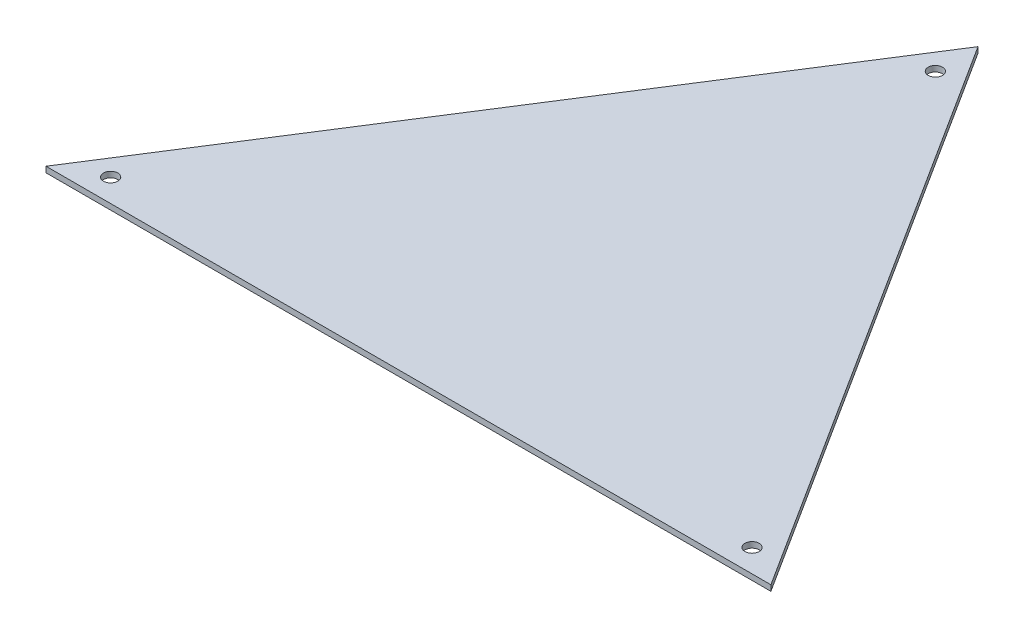
from build123d import *

# Parameters (mm, degrees)
SKETCH1_R           = 3.96875
BOSS_EXTRUDE1_DEPTH = 1.5875


with BuildPart() as part:
    # Sketch1 → Boss-Extrude1 (new, symmetric)
    with BuildSketch(Plane(origin=(0, 0, 0), x_dir=(1, 0, 0), z_dir=(0, 1, 0))):
        Polygon((0, 303.055391585), (-200.93524919, -12.7), (200.93524919, -12.7), align=None)
        with Locations(Location((-177.8, 0, 0), (0, 0, 270))):
            Circle(SKETCH1_R, mode=Mode.SUBTRACT)
        with Locations(Location((0, 279.4, 0), (0, 0, 270))):
            Circle(SKETCH1_R, mode=Mode.SUBTRACT)
        with Locations(Location((177.8, 0, 0), (0, 0, 270))):
            Circle(SKETCH1_R, mode=Mode.SUBTRACT)
    extrude(amount=BOSS_EXTRUDE1_DEPTH, both=True)


solid = part.part
